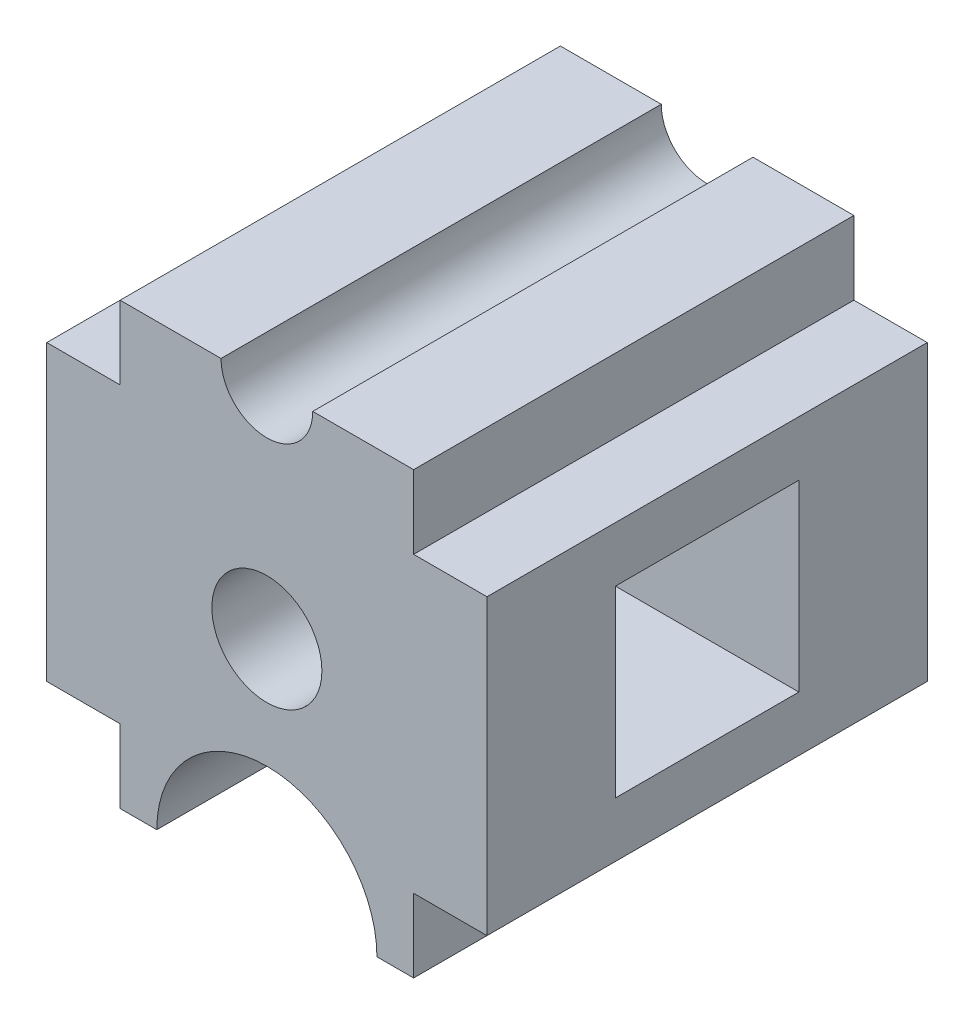
from build123d import *

# Parameters (mm, degrees)
SKETCH1_W           = 120
SKETCH1_H           = 120
BOSS_EXTRUDE1_DEPTH = 120
SKETCH2_R           = 30
SKETCH2_W           = 20
SKETCH2_H           = 20
CUT_EXTRUDE1_DEPTH  = 120
SKETCH4_R           = 15
CUT_EXTRUDE2_DEPTH  = 120
SKETCH5_W           = 20
SKETCH5_H           = 20
CUT_EXTRUDE3_DEPTH  = 120
SKETCH6_W           = 50
SKETCH6_H           = 50
CUT_EXTRUDE4_DEPTH  = 120


with BuildPart() as part:
    # Sketch1 → Boss-Extrude1 (new body)
    with BuildSketch(Plane.XY):
        Rectangle(SKETCH1_W, SKETCH1_H)
    extrude(amount=BOSS_EXTRUDE1_DEPTH)

    # Sketch2 → Cut-Extrude1 (cut)
    with BuildSketch(Plane.XY.offset(120)):
        with Locations((0, -60)):
            Circle(SKETCH2_R)
        with Locations((50, -50)):
            Rectangle(SKETCH2_W, SKETCH2_H)
        with Locations((-50, -50)):
            Rectangle(SKETCH2_W, SKETCH2_H)
    extrude(amount=-CUT_EXTRUDE1_DEPTH, mode=Mode.SUBTRACT)

    # Sketch4 → Cut-Extrude2 (cut)
    with BuildSketch(Plane.XY.offset(120)):
        Circle(SKETCH4_R)
    extrude(amount=-CUT_EXTRUDE2_DEPTH, mode=Mode.SUBTRACT)

    # Sketch5 → Cut-Extrude3 (cut)
    with BuildSketch(Plane.XY.offset(120)):
        with Locations((-50, 50)):
            Rectangle(SKETCH5_W, SKETCH5_H)
        with BuildLine():
            Line((0, 60), (-12.5, 60))
            ThreePointArc((-12.5, 60), (-8.838834765, 51.161165235), (0, 47.5))
            Line((0, 47.5), (0, 60))
        make_face()
        with BuildLine():
            Line((0, 60), (0, 47.5))
            ThreePointArc((0, 47.5), (8.838834765, 51.161165235), (12.5, 60))
            Line((12.5, 60), (0, 60))
        make_face()
        with Locations((50, 50)):
            Rectangle(SKETCH5_W, SKETCH5_H)
    extrude(amount=-CUT_EXTRUDE3_DEPTH, mode=Mode.SUBTRACT)

    # Sketch6 → Cut-Extrude4 (cut)
    with BuildSketch(Plane(origin=(60, 0, 0), x_dir=(0, 0, -1), z_dir=(1, 0, 0))):
        with Locations((-60, 0)):
            Rectangle(SKETCH6_W, SKETCH6_H)
    extrude(amount=-CUT_EXTRUDE4_DEPTH, mode=Mode.SUBTRACT)


solid = part.part
